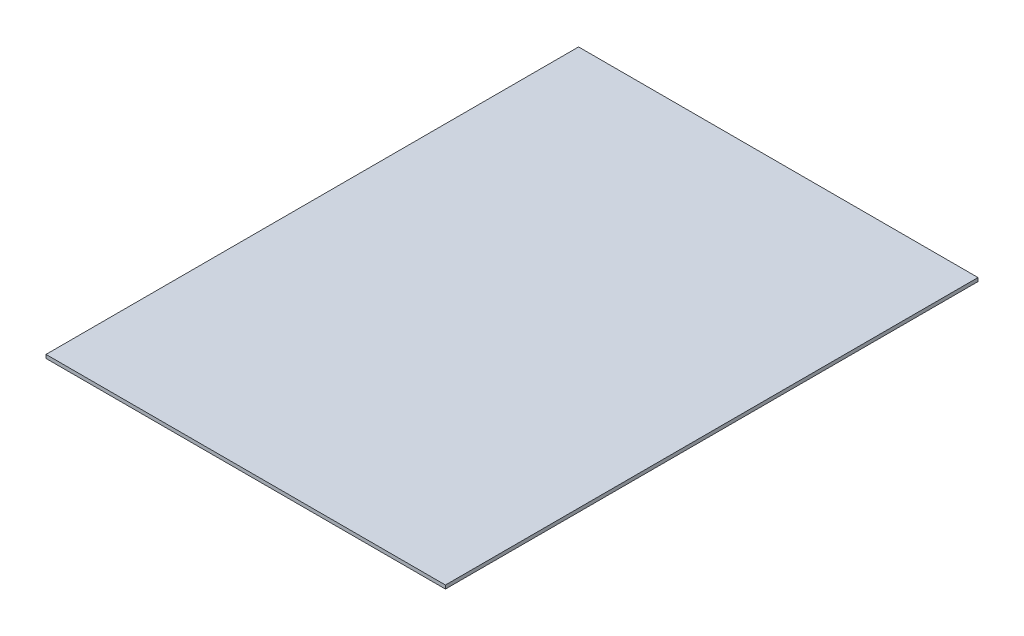
from build123d import *

# Parameters (mm, degrees)
SKETCH3_W           = 609.6
SKETCH3_H           = 1.524
BOSS_EXTRUDE1_DEPTH = 304.8
SKETCH6_OUTSIDE_W   = 784.022
SKETCH6_OUTSIDE_H   = 784.022
SKETCH6_OUTSIDE_W_2 = 171.45
SKETCH6_OUTSIDE_H_2 = 228.6
CUT_EXTRUDE1_DEPTH  = 432.05498788


with BuildPart() as part:
    # Sketch3 → Boss-Extrude1 (new, symmetric)
    with BuildSketch(Plane.XY):
        Rectangle(SKETCH3_W, SKETCH3_H)
    extrude(amount=BOSS_EXTRUDE1_DEPTH, both=True)

    # Sketch6 outside → Cut-Extrude1 (cut, through all)
    with BuildSketch(Plane(origin=(0, 0.762, 0), x_dir=(1, 0, 0), z_dir=(0, 1, 0))):
        Rectangle(SKETCH6_OUTSIDE_W, SKETCH6_OUTSIDE_H)
        with Locations((-219.075, -190.5)):
            Rectangle(SKETCH6_OUTSIDE_W_2, SKETCH6_OUTSIDE_H_2, mode=Mode.SUBTRACT)
    extrude(amount=-CUT_EXTRUDE1_DEPTH, mode=Mode.SUBTRACT)


solid = part.part
